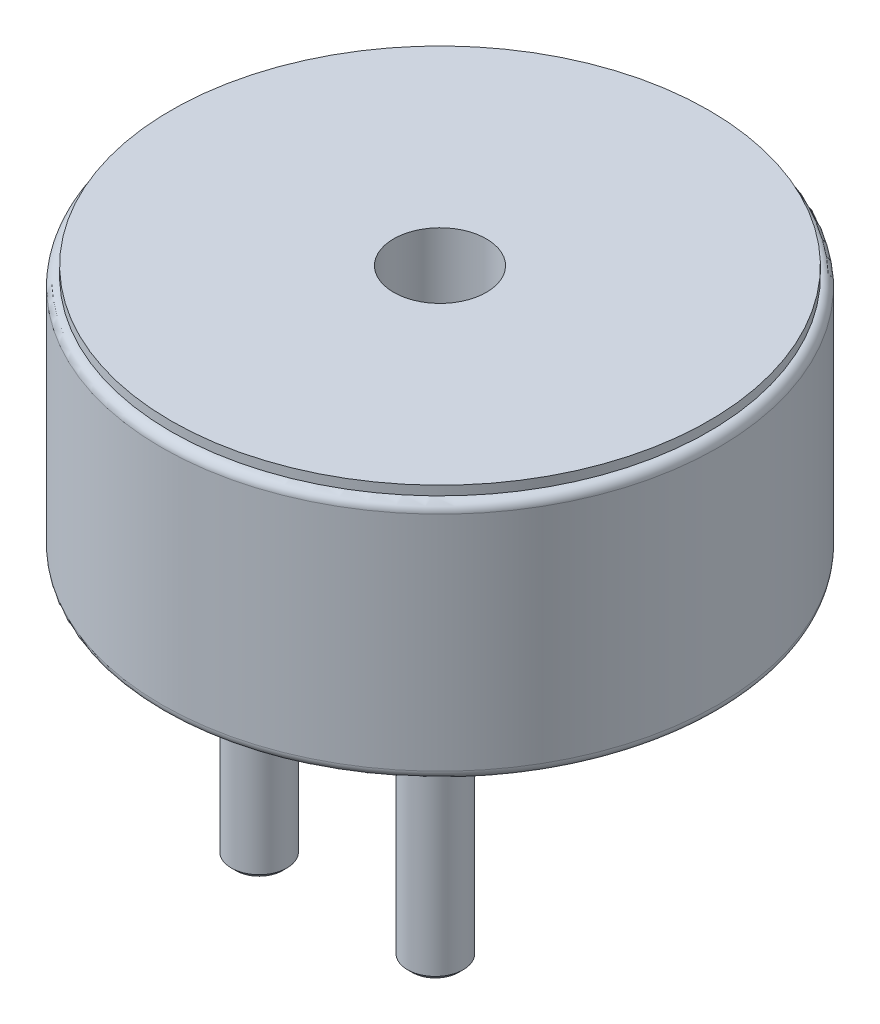
from build123d import *

# Parameters (mm, degrees)
SKETCH1_R           = 3
BOSS_EXTRUDE1_DEPTH = 2.6
FILLET1_R           = 0.1
SKETCH3_R           = 2.9
BOSS_EXTRUDE2_DEPTH = 0.1
SKETCH2_R           = 0.5
CUT_EXTRUDE1_DEPTH  = 1
SKETCH4_R           = 0.3
BOSS_EXTRUDE3_DEPTH = 2.8
CHAMFER1_SIZE       = 0.05


with BuildPart() as part:
    # Sketch1 → Boss-Extrude1 (new body)
    with BuildSketch(Plane(origin=(0, 0, 0), x_dir=(1, 0, 0), z_dir=(0, 1, 0))):
        with Locations(Location((0, 0, 0), (0, 0, 270))):
            Circle(SKETCH1_R)
    extrude(amount=BOSS_EXTRUDE1_DEPTH)

    # Fillet1
    fillet1_edges = [part.edges().sort_by_distance(p)[0] for p in [
        (0, 0, -3),
        (0, 2.6, -3),
    ]]
    fillet(fillet1_edges, radius=FILLET1_R)

    # Sketch3 → Boss-Extrude2 (add)
    with BuildSketch(Plane(origin=(0, 2.6, 0), x_dir=(1, 0, 0), z_dir=(0, 1, 0))):
        with Locations(Location((0, 0, 0), (0, 0, 270))):
            Circle(SKETCH3_R)
    extrude(amount=BOSS_EXTRUDE2_DEPTH)

    # Sketch2 → Cut-Extrude1 (cut)
    with BuildSketch(Plane(origin=(0, 2.7, 0), x_dir=(1, 0, 0), z_dir=(0, 1, 0))):
        with Locations(Location((0, 0, 0), (0, 0, 270))):
            Circle(SKETCH2_R)
    extrude(amount=-CUT_EXTRUDE1_DEPTH, mode=Mode.SUBTRACT)

    # Sketch4 → Boss-Extrude3 (add)
    with BuildSketch(Plane.XZ):
        with Locations(Location((-0.95, 1, 0), (0, 0, 90))):
            Circle(SKETCH4_R)
        with Locations(Location((0.95, 1, 0), (0, 0, 90))):
            Circle(SKETCH4_R)
    extrude(amount=BOSS_EXTRUDE3_DEPTH)

    # Chamfer1
    chamfer1_edges = [part.edges().sort_by_distance(p)[0] for p in [
        (-0.95, -2.8, 0.7),
        (0.95, -2.8, 0.7),
    ]]
    chamfer(chamfer1_edges, length=CHAMFER1_SIZE)


solid = part.part
